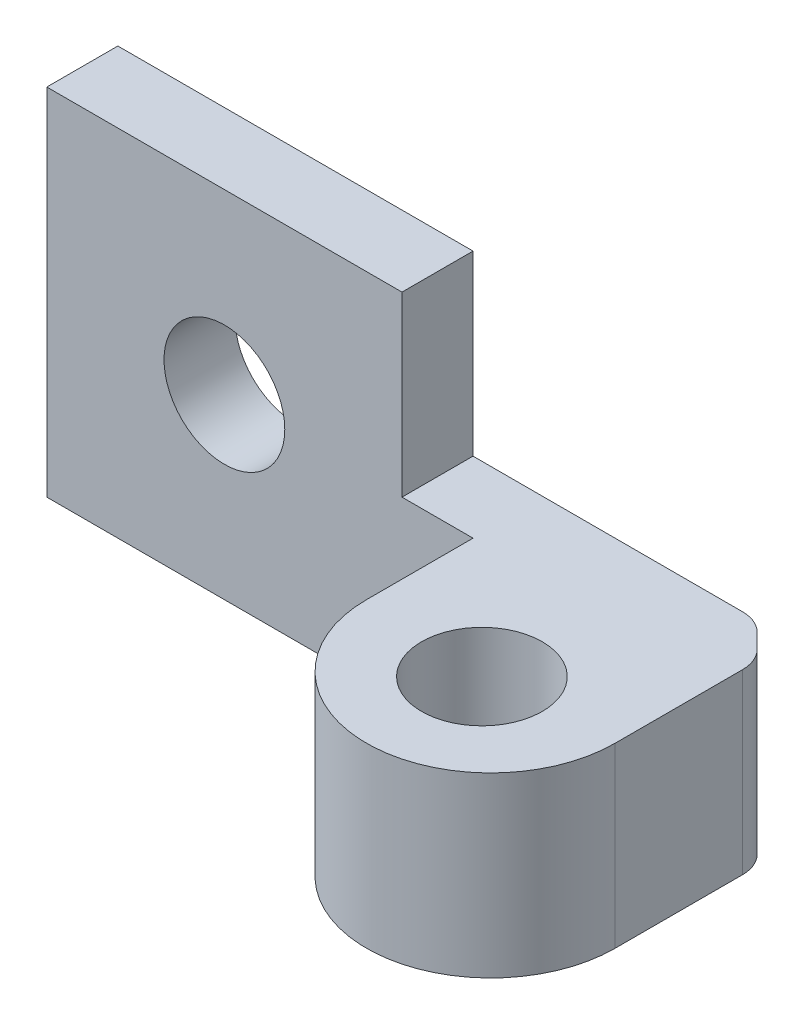
from build123d import *

# Parameters (mm, degrees)
ESTRUSIONE_ESTRUSIONE1_DEPTH = 2
SCHIZZO2_W                   = 7
SCHIZZO2_H                   = 5
ESTRUSIONE_ESTRUSIONE2_DEPTH = 6.5
FORO_PER_VITE_M3_1_D         = 3.4
FORO_PER_VITE_M3_1_DEPTH     = 2
FORO_PER_VITE_M3_1_TIP       = 1.021463052
FORO_PER_VITE_M3_2_D         = 3.4
RACCORDO1_RADIUS             = 3.5
RACCORDO1_LENGTH             = 5
SMUSSO1_SIZE                 = 1
RACCORDO2_R                  = 1


with BuildPart() as part:
    # Schizzo1 → Estrusione-Estrusione1 (new body)
    with BuildSketch(Plane.XY):
        Polygon((5, 5), (5, 0), (14, 0), (14, -5), (5, -5), (-5, -5), (-5, 5), align=None)
    extrude(amount=ESTRUSIONE_ESTRUSIONE1_DEPTH)

    # Schizzo2 → Estrusione-Estrusione2 (add)
    with BuildSketch(Plane.XY.offset(2)):
        with Locations((10.5, -2.5)):
            Rectangle(SCHIZZO2_W, SCHIZZO2_H)
    extrude(amount=ESTRUSIONE_ESTRUSIONE2_DEPTH)

    # Foro per Vite M3-1
    with Locations(Plane.XY.offset(2)):
        with Locations((0, 0)):
            Hole(FORO_PER_VITE_M3_1_D / 2, depth=FORO_PER_VITE_M3_1_DEPTH)
            with Locations((0, 0, -(FORO_PER_VITE_M3_1_DEPTH + FORO_PER_VITE_M3_1_TIP / 2))):  # 118° drill point
                Cone(0, FORO_PER_VITE_M3_1_D / 2, FORO_PER_VITE_M3_1_TIP, mode=Mode.SUBTRACT)

    # Foro per Vite M3-2 (through all)
    with Locations(Plane(origin=(0, -5, 0), x_dir=(-1, 0, 0), z_dir=(0, -1, 0))):
        with Locations((-10.5, -5.25)):
            Hole(FORO_PER_VITE_M3_2_D / 2)

    # Raccordo1: full round fillet: the end face becomes a half cylinder, R = half its width
    raccordo1_face = Plane((10.5, -2.5, 8.5), x_dir=(0, 1, 0), z_dir=(0, 0, 1))  # on the end face: x along it, z out of the body
    raccordo1_slab = raccordo1_face.offset(-RACCORDO1_RADIUS / 2) * Box(RACCORDO1_LENGTH, 2 * RACCORDO1_RADIUS, RACCORDO1_RADIUS, mode=Mode.PRIVATE)  # the body's end, R deep
    raccordo1_round = Plane((10.5, -2.5, 5), x_dir=(0, 0, 1), z_dir=(0, 1, 0)) * Cylinder(RACCORDO1_RADIUS, RACCORDO1_LENGTH, mode=Mode.PRIVATE)  # its axis R under the face
    add(raccordo1_slab - raccordo1_round, mode=Mode.SUBTRACT)

    # Smusso1
    smusso1_edges = [part.edges().sort_by_distance(p)[0] for p in [
        (14, -2.5, 0),
    ]]
    chamfer(smusso1_edges, length=SMUSSO1_SIZE)

    # Raccordo2
    raccordo2_edges = [part.edges().sort_by_distance(p)[0] for p in [
        (14, -2.5, 1),
        (13, -2.5, 0),
    ]]
    fillet(raccordo2_edges, radius=RACCORDO2_R)


solid = part.part
